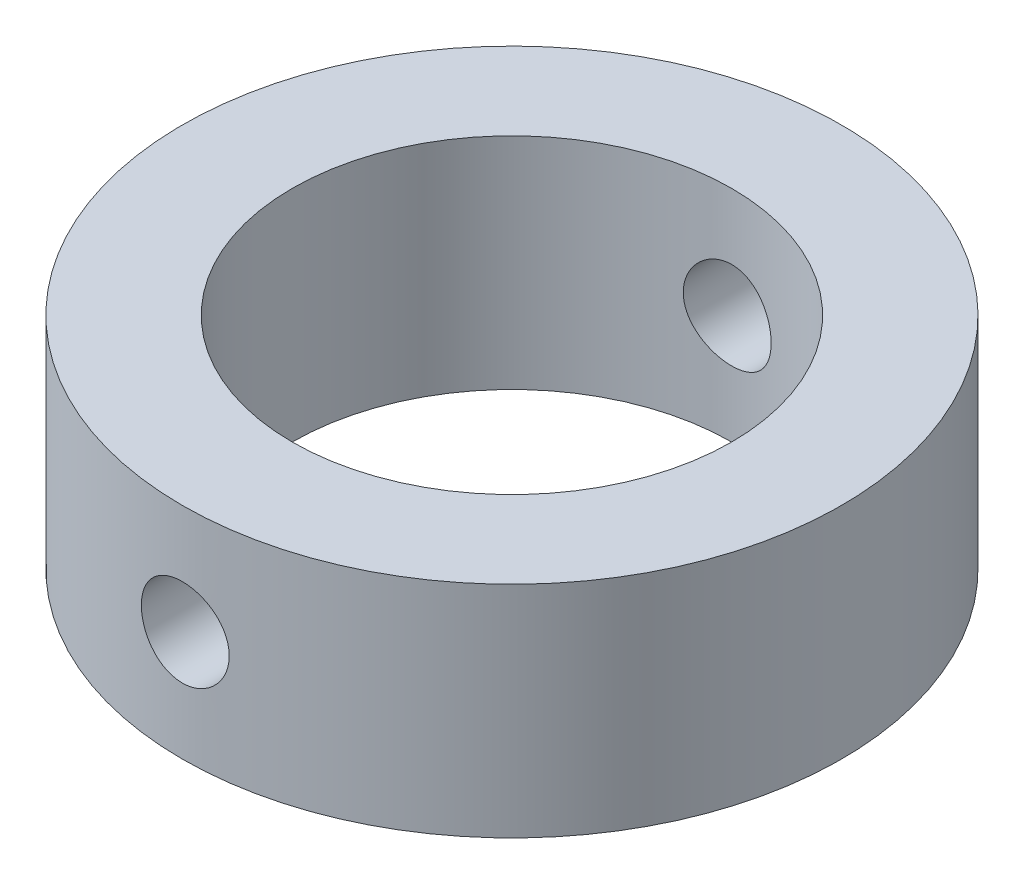
from build123d import *

# Parameters (mm, degrees)
SKETCH1_R               = 22.5
SKETCH1_R_2             = 15
BOSS_EXTRUDE1_DEPTH     = 15
CUT_EXTRUDE1_DEPTH      = 36.178118199
CUT_EXTRUDE1_DEPTH_BACK = 36.178118199
SKETCH2_R               = 3


with BuildPart() as part:
    # Sketch1 → Boss-Extrude1 (new body)
    with BuildSketch(Plane(origin=(0, 0, 0), x_dir=(1, 0, 0), z_dir=(0, 1, 0))):
        with Locations(Location((0, 0, 0), (0, 0, 270))):
            Circle(SKETCH1_R)
        with Locations(Location((0, 0, 0), (0, 0, 270))):
            Circle(SKETCH1_R_2, mode=Mode.SUBTRACT)
    extrude(amount=BOSS_EXTRUDE1_DEPTH)

    # Sketch2 → Cut-Extrude1 (cut, two sides: drawn at the far end of the back side and taken through both)
    with BuildSketch(Plane.XY.offset(-CUT_EXTRUDE1_DEPTH_BACK)):
        with Locations((0, 7.5)):
            Circle(SKETCH2_R)
    extrude(amount=CUT_EXTRUDE1_DEPTH + CUT_EXTRUDE1_DEPTH_BACK, mode=Mode.SUBTRACT)


solid = part.part
